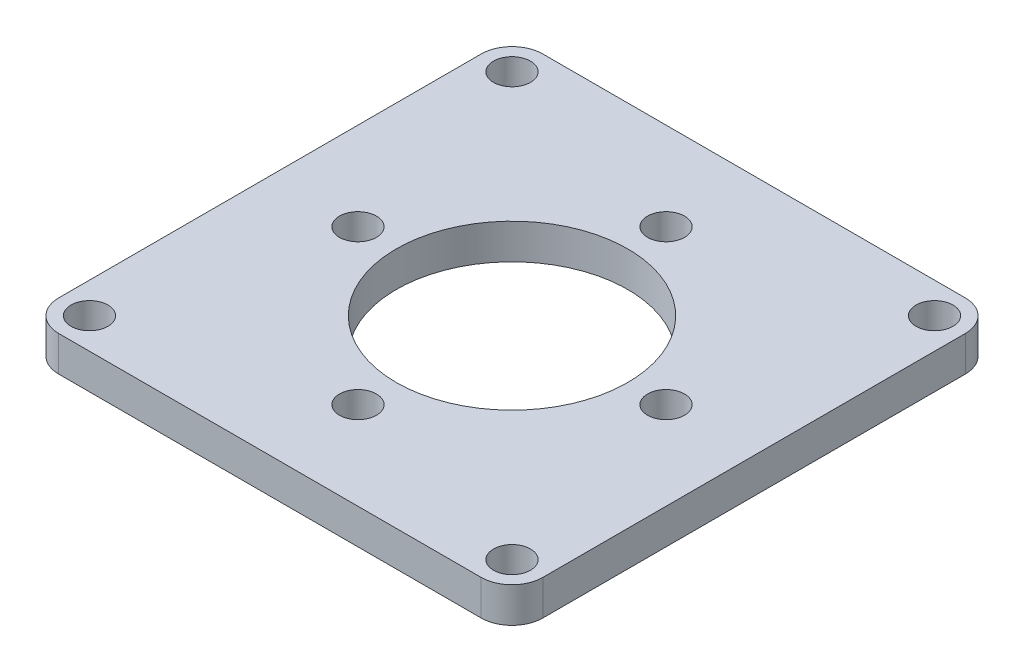
from build123d import *

# Parameters (mm, degrees)
SKETCH_1_W               = 55
SKETCH_1_H               = 55
EXTRUDE_1_DEPTH          = 4
FILLET_1_R               = 3.5
SKETCH_2_R               = 13.15
CUT_EXTRUDE_1_DEPTH      = 4
SKETCH_3_R               = 2.1
CUT_EXTRUDE_2_DEPTH      = 4
PATTERN_CIRCULAR_1_COUNT = 4
CUT_EXTRUDE_3_DEPTH      = 4
PATTERN_CIRCULAR_2_COUNT = 4


with BuildPart() as part:
    # 草图1 → 凸台-拉伸1 (new body)
    with BuildSketch(Plane(origin=(0, 0, 0), x_dir=(1, 0, 0), z_dir=(0, 1, 0))):
        Rectangle(SKETCH_1_W, SKETCH_1_H)
    extrude(amount=EXTRUDE_1_DEPTH)

    # 圆角1
    fillet_1_edges = [part.edges().sort_by_distance(p)[0] for p in [
        (27.5, 2, 27.5),
        (-27.5, 2, 27.5),
        (-27.5, 2, -27.5),
        (27.5, 2, -27.5),
    ]]
    fillet(fillet_1_edges, radius=FILLET_1_R)

    # 草图2 → 切除-拉伸1 (cut)
    with BuildSketch(Plane(origin=(0, 4, 0), x_dir=(1, 0, 0), z_dir=(0, 1, 0))):
        with Locations(Location((0, 0, 0), (0, 0, 270))):
            Circle(SKETCH_2_R)
    extrude(amount=-CUT_EXTRUDE_1_DEPTH, mode=Mode.SUBTRACT)

    # 草图3 → 切除-拉伸2 (cut)
    with BuildSketch(Plane(origin=(0, 4, 0), x_dir=(1, 0, 0), z_dir=(0, 1, 0))):
        with Locations(Location((0, 17.5, 0), (0, 0, 270))):
            Circle(SKETCH_3_R)
    cut_extrude_2 = extrude(amount=-CUT_EXTRUDE_2_DEPTH, mode=Mode.SUBTRACT)

    # 阵列(圆周)1: 切除-拉伸2 ×4 about axis
    pattern_circular_1_axis = Axis((0, 0, 0), (0, 1, 0))
    for i in range(1, PATTERN_CIRCULAR_1_COUNT):
        add(cut_extrude_2.rotate(pattern_circular_1_axis, i * 360 / PATTERN_CIRCULAR_1_COUNT), mode=Mode.SUBTRACT)

    # 草图4 → 切除-拉伸3 (cut)
    with BuildSketch(Plane(origin=(0, 4, 0), x_dir=(1, 0, 0), z_dir=(0, 1, 0))):
        with BuildLine():
            ThreePointArc((-21.9, 24), (-25.48492424, 25.48492424), (-24, 21.9))
            Line((-24, 21.9), (-24, 24))
            Line((-24, 24), (-21.9, 24))
        make_face()
        with BuildLine():
            Line((-24, 24), (-24, 21.9))
            ThreePointArc((-24, 21.9), (-22.51507576, 22.51507576), (-21.9, 24))
            Line((-21.9, 24), (-24, 24))
        make_face()
    cut_extrude_3 = extrude(amount=-CUT_EXTRUDE_3_DEPTH, mode=Mode.SUBTRACT)

    # 阵列(圆周)2: 切除-拉伸3 ×4 about axis
    pattern_circular_2_axis = Axis((0, 0, 0), (0, 1, 0))
    for i in range(1, PATTERN_CIRCULAR_2_COUNT):
        add(cut_extrude_3.rotate(pattern_circular_2_axis, i * 360 / PATTERN_CIRCULAR_2_COUNT), mode=Mode.SUBTRACT)


solid = part.part
